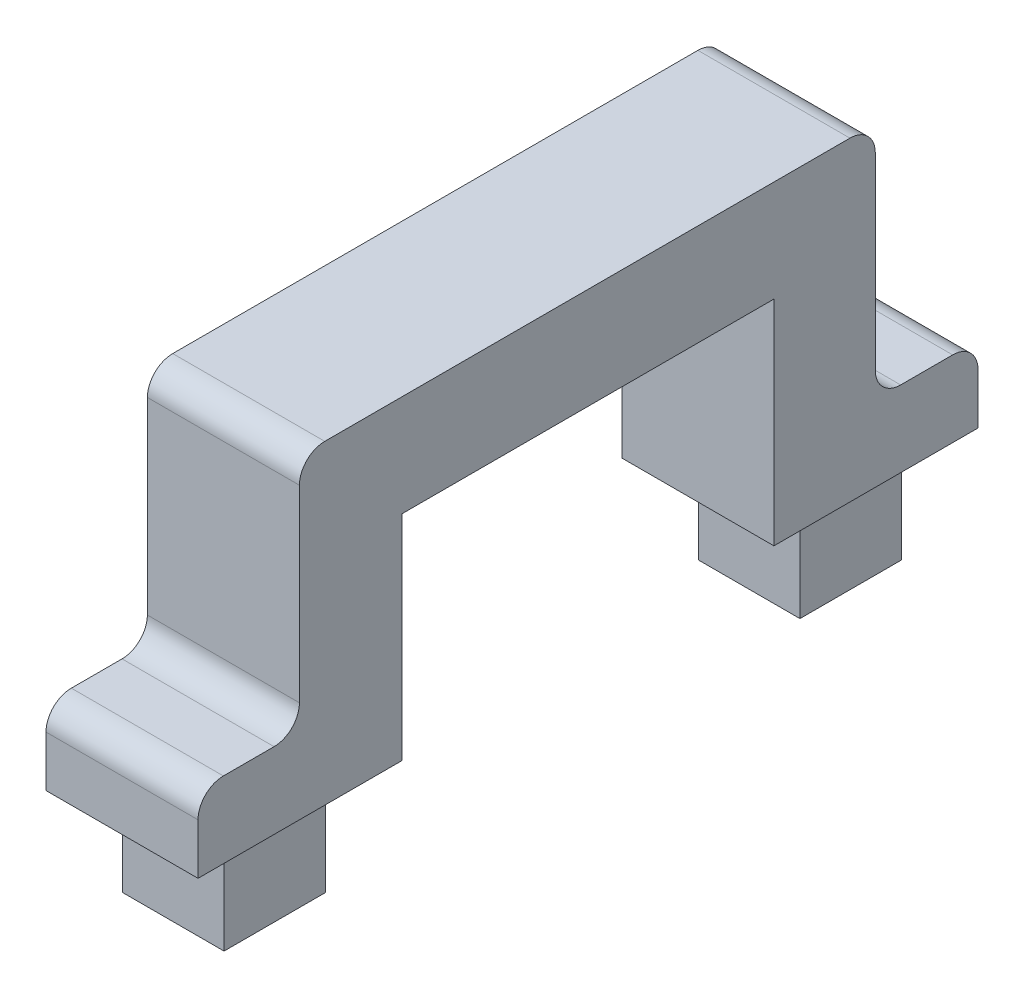
from build123d import *

# Parameters (mm, degrees)
BOSS_EXTRUDE1_DEPTH = 9.525
SKETCH3_R           = 0.508
CUT_EXTRUDE2_DEPTH  = 6.35
FILLET1_R           = 1.5875
ESQUISSE1_W         = 6.35
ESQUISSE1_H         = 6.35
BOSS_EXTRU_1_DEPTH  = 6.35


with BuildPart() as part:
    # Sketch1 → Boss-Extrude1 (new body)
    with BuildSketch(Plane(origin=(0, 0, 0), x_dir=(0, 0, -1), z_dir=(1, 0, 0))):
        Polygon((0, 0), (12.7847852, 0), (12.7847852, 13.390245), (36.0778552, 13.390245), (36.0778552, 0), (48.8626404, 0), (48.8626404, 4.7625), (42.4278552, 4.7625), (42.4278552, 19.740245), (41.4309052, 19.740245), (6.3509652, 19.740245), (6.3509652, 4.7625), (0, 4.7625), align=None)
    extrude(amount=BOSS_EXTRUDE1_DEPTH)

    # Sketch3 → Cut-Extrude2 (cut)
    with BuildSketch(Plane.ZY):
        with Locations((-38.3232152, 6.68528)):
            Circle(SKETCH3_R)
        with Locations((-10.5229152, 6.6951225)):
            Circle(SKETCH3_R)
    extrude(amount=-CUT_EXTRUDE2_DEPTH, mode=Mode.SUBTRACT)

    # Fillet1
    fillet1_edges = [part.edges().sort_by_distance(p)[0] for p in [
        (4.7625, 4.7625, 0),
        (4.7625, 4.7625, -6.3509652),
        (4.7625, 19.740245, -6.3509652),
        (4.7625, 19.740245, -42.4278552),
        (4.7625, 4.7625, -42.4278552),
        (4.7625, 4.7625, -48.8626404),
    ]]
    fillet(fillet1_edges, radius=FILLET1_R)

    # Esquisse1 → Boss.-Extru.1 (add)
    with BuildSketch(Plane.XZ):
        with Locations((4.7625, -42.4702478)):
            Rectangle(ESQUISSE1_W, ESQUISSE1_H)
        with Locations((4.7625, -6.3923926)):
            Rectangle(ESQUISSE1_W, ESQUISSE1_H)
    extrude(amount=BOSS_EXTRU_1_DEPTH)


solid = part.part
